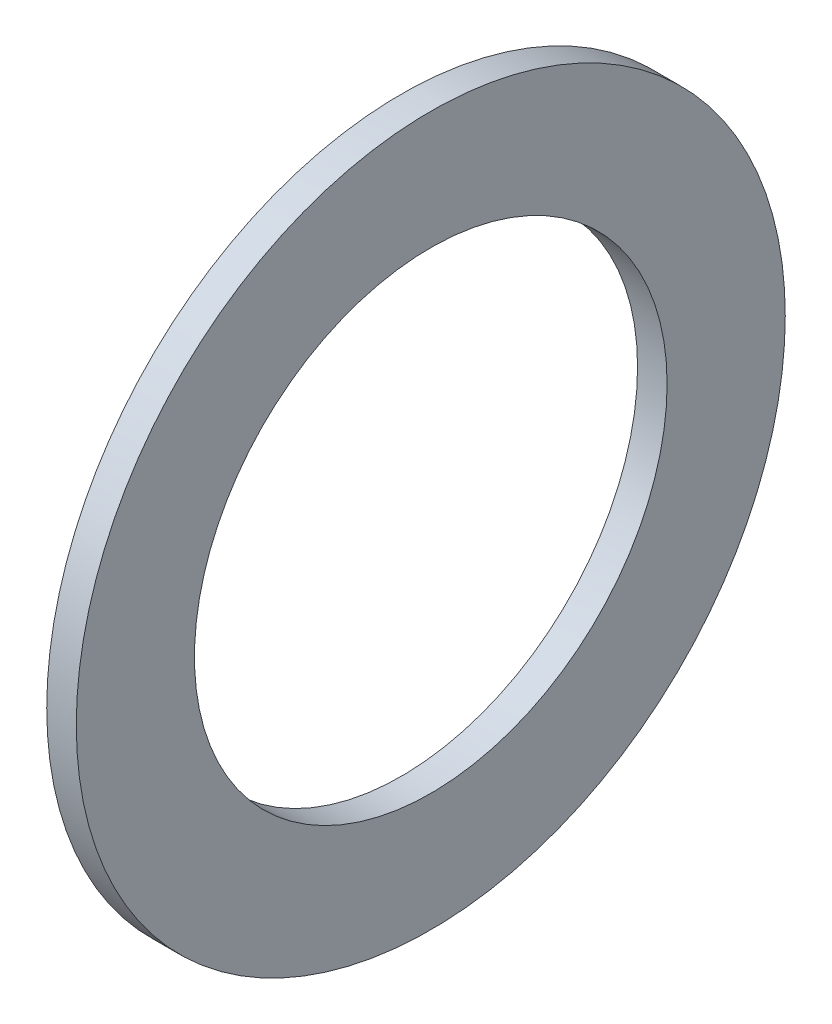
from build123d import *

# Parameters (mm, degrees)
SKETCH1_R           = 76.2
SKETCH1_R_2         = 50.8
BOSS_EXTRUDE1_DEPTH = 6.35


with BuildPart() as part:
    # Sketch1 → Boss-Extrude1 (new body)
    with BuildSketch(Plane(origin=(0, 0, 0), x_dir=(0, 0, -1), z_dir=(1, 0, 0))):
        Circle(SKETCH1_R)
        Circle(SKETCH1_R_2, mode=Mode.SUBTRACT)
    extrude(amount=BOSS_EXTRUDE1_DEPTH)


solid = part.part
